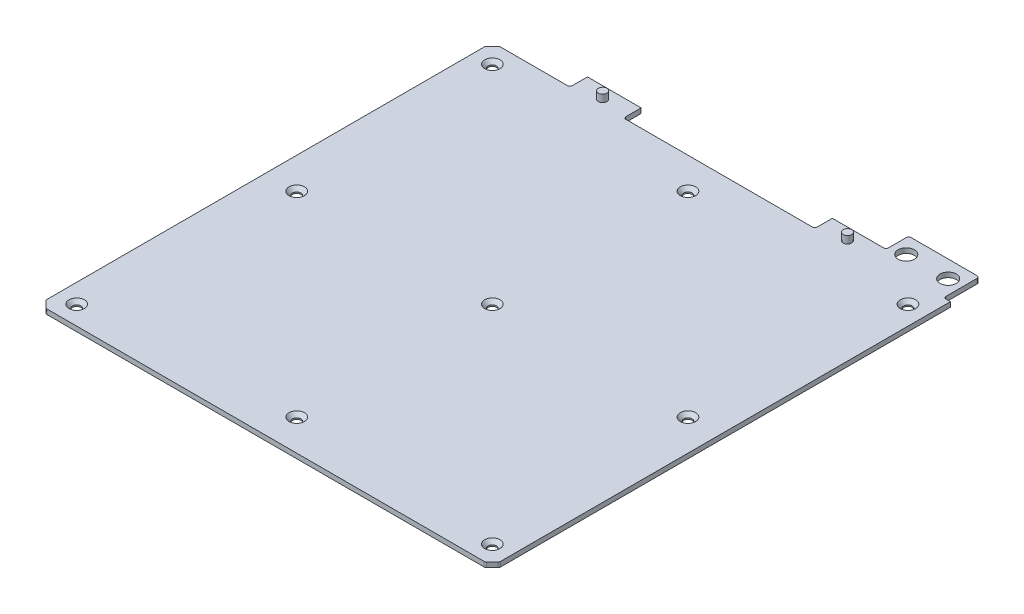
from build123d import *

# Parameters (mm, degrees)
BOSS_EXTRU_1_DEPTH                             = 2
ESQUISSE5_W                                    = 154.2
ESQUISSE5_H                                    = 2
BOSS_EXTRU_2_DEPTH                             = 16.5
ESQUISSE9_W                                    = 2.8
ESQUISSE9_H                                    = 14.7
ENL_V_MAT_EXTRU_1_DEPTH                        = 144.677590459
ESQUISSE10_W                                   = 122.4
ESQUISSE10_H                                   = 9.3
ENL_V_MAT_EXTRU_2_DEPTH                        = 144.677590459
ESQUISSE11_W                                   = 78.4
ESQUISSE11_H                                   = 7.2
ENL_V_MAT_EXTRU_3_DEPTH                        = 144.677590459
CSK_FOR_M3_FLAT_HEAD_MACHINE_SCREW1_AT_2_COUNT = 2
CSK_FOR_M3_FLAT_HEAD_MACHINE_SCREW1_AT_2_PITCH = 160.4
CSK_FOR_M3_FLAT_HEAD_MACHINE_SCREW1_AT_3_COUNT = 2
CSK_FOR_M3_FLAT_HEAD_MACHINE_SCREW1_AT_3_PITCH = 85.346587512
CSK_FOR_M3_FLAT_HEAD_MACHINE_SCREW1_AT_4_COUNT = 2
CSK_FOR_M3_FLAT_HEAD_MACHINE_SCREW1_AT_4_PITCH = 113.419927702
CSK_FOR_M3_FLAT_HEAD_MACHINE_SCREW1_AT_5_COUNT = 2
CSK_FOR_M3_FLAT_HEAD_MACHINE_SCREW1_AT_5_PITCH = 186.054293151
CSK_FOR_M3_FLAT_HEAD_MACHINE_SCREW1_AT_6_COUNT = 2
CSK_FOR_M3_FLAT_HEAD_MACHINE_SCREW1_AT_6_PITCH = 186.054293151
CSK_FOR_M3_FLAT_HEAD_MACHINE_SCREW1_AT_7_COUNT = 2
CSK_FOR_M3_FLAT_HEAD_MACHINE_SCREW1_AT_7_PITCH = 85.346587512
CSK_FOR_M3_FLAT_HEAD_MACHINE_SCREW1_AT_8_COUNT = 2
CSK_FOR_M3_FLAT_HEAD_MACHINE_SCREW1_AT_8_PITCH = 113.419927702
CSK_FOR_M3_FLAT_HEAD_MACHINE_SCREW1_AT_9_COUNT = 2
CSK_FOR_M3_FLAT_HEAD_MACHINE_SCREW1_AT_9_PITCH = 80.2
F_6_7_6_7_DIAMETER_HOLE1_D                     = 6.7
CONG_1_R                                       = 1
ESQUISSE20_W                                   = 1.75
ESQUISSE20_H                                   = 3
ESQUISSE26_W                                   = 1.75
ESQUISSE26_H                                   = 3


with BuildPart() as part:
    # Esquisse4 → Boss.-Extru.1 (new body)
    with BuildSketch(Plane(origin=(0, 0, 0), x_dir=(1, 0, 0), z_dir=(0, 1, 0))):
        Polygon((93, -90), (93, 93), (-90, 93), (-93, 90), (-93, -90), (-90, -93), (90, -93), align=None)
    extrude(amount=-BOSS_EXTRU_1_DEPTH)

    # Esquisse5 → Boss.-Extru.2 (add)
    with BuildSketch(Plane(origin=(0, 0, -93), x_dir=(-1, 0, 0), z_dir=(0, 0, -1))):
        with Locations((-15.9, -1)):
            Rectangle(ESQUISSE5_W, ESQUISSE5_H)
    extrude(amount=BOSS_EXTRU_2_DEPTH)

    # Esquisse9 → Enlèv. mat.-Extru.1 (cut, through all)
    with BuildSketch(Plane(origin=(0, -2, 0), x_dir=(-1, 0, 0), z_dir=(0, -1, 0))):
        with Locations((-91.6, 102.15)):
            Rectangle(ESQUISSE9_W, ESQUISSE9_H)
    extrude(amount=-ENL_V_MAT_EXTRU_1_DEPTH, mode=Mode.SUBTRACT)

    # Esquisse10 → Enlèv. mat.-Extru.2 (cut, through all)
    with BuildSketch(Plane.XZ.offset(2)):
        with Locations((0, -104.85)):
            Rectangle(ESQUISSE10_W, ESQUISSE10_H)
    extrude(amount=-ENL_V_MAT_EXTRU_2_DEPTH, mode=Mode.SUBTRACT)

    # Esquisse11 → Enlèv. mat.-Extru.3 (cut, through all)
    with BuildSketch(Plane.XZ.offset(2)):
        with Locations((0, -96.6)):
            Rectangle(ESQUISSE11_W, ESQUISSE11_H)
    extrude(amount=-ENL_V_MAT_EXTRU_3_DEPTH, mode=Mode.SUBTRACT)

    # Esquisse12 → CSK for M3 Flat Head Machine Screw1 (revolve, cut)
    with BuildSketch(Plane(origin=(0, 0, -80.2), x_dir=(0, 0, 1), z_dir=(1, 0, 0))):
        Polygon((0, 0), (0, 2), (1.7, 2), (1.7, 1.45), (3.15, 0), align=None)
    csk_for_m3_flat_head_machine_screw1 = revolve(axis=Axis((0, 6.35, -80.2), (0, -1, 0)), mode=Mode.SUBTRACT)

    # CSK for M3 Flat Head Machine Screw1 at 2: CSK for M3 Flat Head Machine Screw1 ×2
    with Locations(*[(0, 0, i * CSK_FOR_M3_FLAT_HEAD_MACHINE_SCREW1_AT_2_PITCH) for i in range(1, CSK_FOR_M3_FLAT_HEAD_MACHINE_SCREW1_AT_2_COUNT)]):
        add(csk_for_m3_flat_head_machine_screw1, mode=Mode.SUBTRACT)

    # CSK for M3 Flat Head Machine Screw1 at 3: CSK for M3 Flat Head Machine Screw1 ×2
    with Locations(*[Vector(0.9982824443647501, 0, -0.058584650490889255) * (i * CSK_FOR_M3_FLAT_HEAD_MACHINE_SCREW1_AT_3_PITCH) for i in range(1, CSK_FOR_M3_FLAT_HEAD_MACHINE_SCREW1_AT_3_COUNT)]):
        add(csk_for_m3_flat_head_machine_screw1, mode=Mode.SUBTRACT)

    # CSK for M3 Flat Head Machine Screw1 at 4: CSK for M3 Flat Head Machine Screw1 ×2
    with Locations(*[Vector(0.7071067811865476, 0, 0.7071067811865476) * (i * CSK_FOR_M3_FLAT_HEAD_MACHINE_SCREW1_AT_4_PITCH) for i in range(1, CSK_FOR_M3_FLAT_HEAD_MACHINE_SCREW1_AT_4_COUNT)]):
        add(csk_for_m3_flat_head_machine_screw1, mode=Mode.SUBTRACT)

    # CSK for M3 Flat Head Machine Screw1 at 5: CSK for M3 Flat Head Machine Screw1 ×2
    with Locations(*[Vector(0.4579308467273681, 0, 0.8889878174730831) * (i * CSK_FOR_M3_FLAT_HEAD_MACHINE_SCREW1_AT_5_PITCH) for i in range(1, CSK_FOR_M3_FLAT_HEAD_MACHINE_SCREW1_AT_5_COUNT)]):
        add(csk_for_m3_flat_head_machine_screw1, mode=Mode.SUBTRACT)

    # CSK for M3 Flat Head Machine Screw1 at 6: CSK for M3 Flat Head Machine Screw1 ×2
    with Locations(*[Vector(-0.4579308467273681, 0, 0.8889878174730831) * (i * CSK_FOR_M3_FLAT_HEAD_MACHINE_SCREW1_AT_6_PITCH) for i in range(1, CSK_FOR_M3_FLAT_HEAD_MACHINE_SCREW1_AT_6_COUNT)]):
        add(csk_for_m3_flat_head_machine_screw1, mode=Mode.SUBTRACT)

    # CSK for M3 Flat Head Machine Screw1 at 7: CSK for M3 Flat Head Machine Screw1 ×2
    with Locations(*[Vector(-0.9982824443647501, 0, -0.058584650490889255) * (i * CSK_FOR_M3_FLAT_HEAD_MACHINE_SCREW1_AT_7_PITCH) for i in range(1, CSK_FOR_M3_FLAT_HEAD_MACHINE_SCREW1_AT_7_COUNT)]):
        add(csk_for_m3_flat_head_machine_screw1, mode=Mode.SUBTRACT)

    # CSK for M3 Flat Head Machine Screw1 at 8: CSK for M3 Flat Head Machine Screw1 ×2
    with Locations(*[Vector(-0.7071067811865476, 0, 0.7071067811865476) * (i * CSK_FOR_M3_FLAT_HEAD_MACHINE_SCREW1_AT_8_PITCH) for i in range(1, CSK_FOR_M3_FLAT_HEAD_MACHINE_SCREW1_AT_8_COUNT)]):
        add(csk_for_m3_flat_head_machine_screw1, mode=Mode.SUBTRACT)

    # CSK for M3 Flat Head Machine Screw1 at 9: CSK for M3 Flat Head Machine Screw1 ×2
    with Locations(*[(0, 0, i * CSK_FOR_M3_FLAT_HEAD_MACHINE_SCREW1_AT_9_PITCH) for i in range(1, CSK_FOR_M3_FLAT_HEAD_MACHINE_SCREW1_AT_9_COUNT)]):
        add(csk_for_m3_flat_head_machine_screw1, mode=Mode.SUBTRACT)

    # Ø6.7 (6.7) Diameter Hole1 (through all)
    with Locations(Plane(origin=(0, -2, 0), x_dir=(-1, 0, 0), z_dir=(0, -1, 0))):
        with Locations((-84.4, 102.5), (-67.2, 102.5)):
            Hole(F_6_7_6_7_DIAMETER_HOLE1_D / 2)

    # Congé1
    cong_1_edges = [part.edges().sort_by_distance(p)[0] for p in [
        (90, -1, 93),
        (-90, -1, 93),
        (-93, -1, 90),
        (-93, -1, -90),
        (-90, -1, -93),
        (93, -1, 90),
        (-61.2, -1, -93),
        (90.2, -1, -109.5),
        (90.2, -1, -94.8),
        (61.2, -1, -109.5),
        (61.2, -1, -100.2),
        (-39.2, -1, -93),
        (39.2, -1, -93),
    ]]
    fillet(cong_1_edges, radius=CONG_1_R)


with BuildPart() as body_2:
    # Esquisse20 → Révolution2 (revolve)
    with BuildSketch(Plane.XY.offset(-95.4), mode=Mode.PRIVATE) as r_volution2_sk:
        with Locations((-49.325, 1.5)):
            Rectangle(ESQUISSE20_W, ESQUISSE20_H)
    revolve(r_volution2_sk.sketch.rotate(Axis((-50.2, 3, -95.4), (0, -1, 0)), 270), axis=Axis((-50.2, 3, -95.4), (0, -1, 0)))


with BuildPart() as body_3:
    # Esquisse26 → Révolution3 (revolve)
    with BuildSketch(Plane.XY.offset(-95.4), mode=Mode.PRIVATE) as r_volution3_sk:
        with Locations((51.075, 1.5)):
            Rectangle(ESQUISSE26_W, ESQUISSE26_H)
    revolve(r_volution3_sk.sketch.rotate(Axis((50.2, 3, -95.4), (0, -1, 0)), 270), axis=Axis((50.2, 3, -95.4), (0, -1, 0)))


solid = Compound([part.part, body_2.part, body_3.part])
